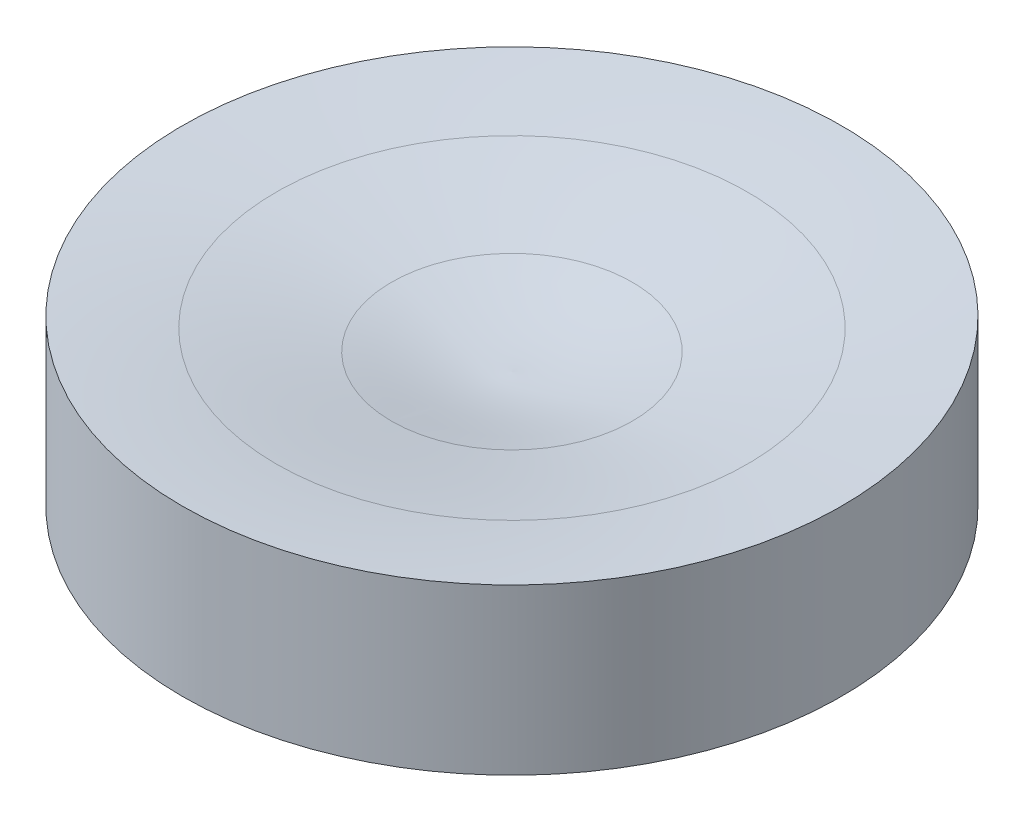
from build123d import *


with BuildPart() as part:
    # Sketch1 → Revolve2 (revolve)
    with BuildSketch(Plane(origin=(0, 0, 0), x_dir=(0, 0, -1), z_dir=(1, 0, 0))):
        with BuildLine():
            Line((0, 0), (0, 1.409881482))
            add(Edge.make_bspline(
                [(0, 1.409881482), (-0.49563057, 1.384632652), (-0.977649174, 1.51645743), (-1.461462843, 1.624028414)],
                knots=[0.937044655, 0.937044655, 0.937044655, 0.937044655, 1.30274738, 1.30274738, 1.30274738, 1.30274738], degree=3))
            add(Edge.make_bspline(
                [(-2.859700783, 1.872604048), (-2.391935239, 1.801412307), (-1.92676807, 1.712251769), (-1.461462843, 1.624028414)],
                knots=[0.302499858, 0.302499858, 0.302499858, 0.302499858, 0.676912537, 0.676912537, 0.676912537, 0.676912537], degree=3))
            add(Edge.make_bspline(
                [(-4, 2), (-3.617994461, 1.966135213), (-3.238039539, 1.924714957), (-2.859700783, 1.872604048)],
                knots=[0, 0, 0, 0, 0.283455875, 0.283455875, 0.283455875, 0.283455875], degree=3))
            Line((-4, 2), (-4, 0))
            Line((-4, 0), (0, 0))
        make_face()
    revolve(axis=Axis((0, 1.409881482, 0), (0, -1, 0)))


solid = part.part
